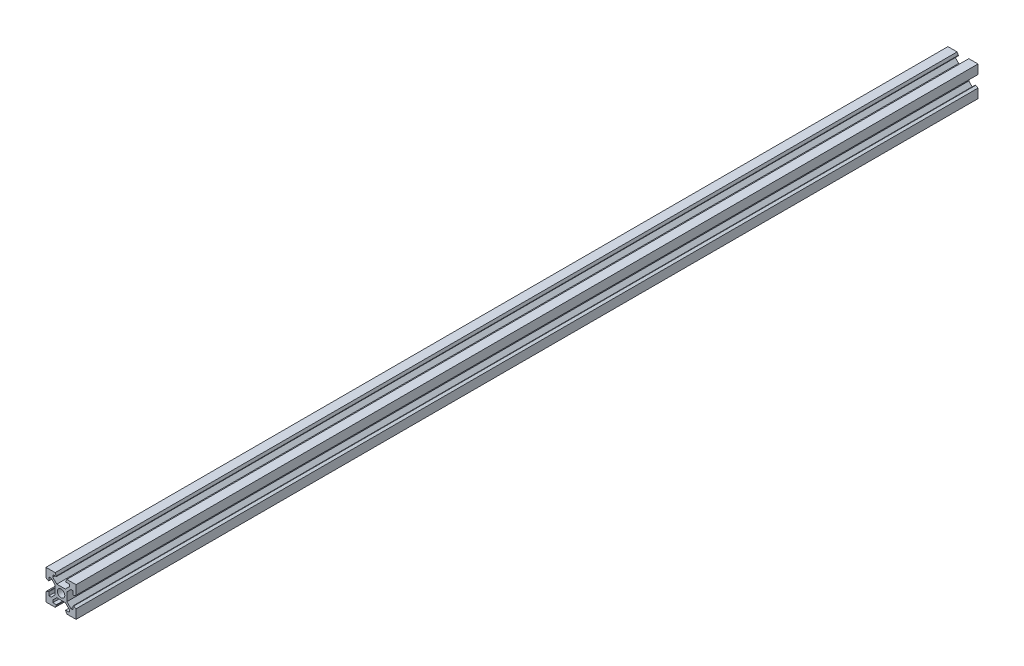
from build123d import *

# Parameters (mm, degrees)
SKETCH1_R           = 2.5
BOSS_EXTRUDE1_DEPTH = 600


with BuildPart() as part:
    # Sketch1 → Boss-Extrude1 (new body)
    with BuildSketch(Plane.XY):
        Polygon((6.1, 20), (0, 20), (0, 13.895792909), (1.56, 13.1), (1.9, 13.1), (1.9, 15.5), (3.439339828, 15.5), (6.1, 12.839339828), (6.1, 7.160660172), (3.439339828, 4.5), (1.9, 4.5), (1.9, 6.9), (1.56, 6.9), (0, 6.104207091), (0, 0), (6.1, 0), (6.9, 1.56), (6.9, 1.9), (4.5, 1.9), (4.5, 3.439339828), (7.160660172, 6.1), (12.839339828, 6.1), (15.5, 3.439339828), (15.5, 1.9), (13.1, 1.9), (13.1, 1.56), (13.9, 0), (20, 0), (20, 6.104207091), (18.44, 6.9), (18.1, 6.9), (18.1, 4.5), (16.560660172, 4.5), (13.9, 7.160660172), (13.9, 12.839339828), (16.560660172, 15.5), (18.1, 15.5), (18.1, 13.1), (18.44, 13.1), (20, 13.895792909), (20, 20), (13.9, 20), (13.1, 18.44), (13.1, 18.1), (15.5, 18.1), (15.5, 16.560660172), (12.839339828, 13.9), (7.160660172, 13.9), (4.5, 16.560660172), (4.5, 18.1), (6.9, 18.1), (6.9, 18.44), align=None)
        with Locations((10, 10)):
            Circle(SKETCH1_R, mode=Mode.SUBTRACT)
    extrude(amount=BOSS_EXTRUDE1_DEPTH)


solid = part.part
